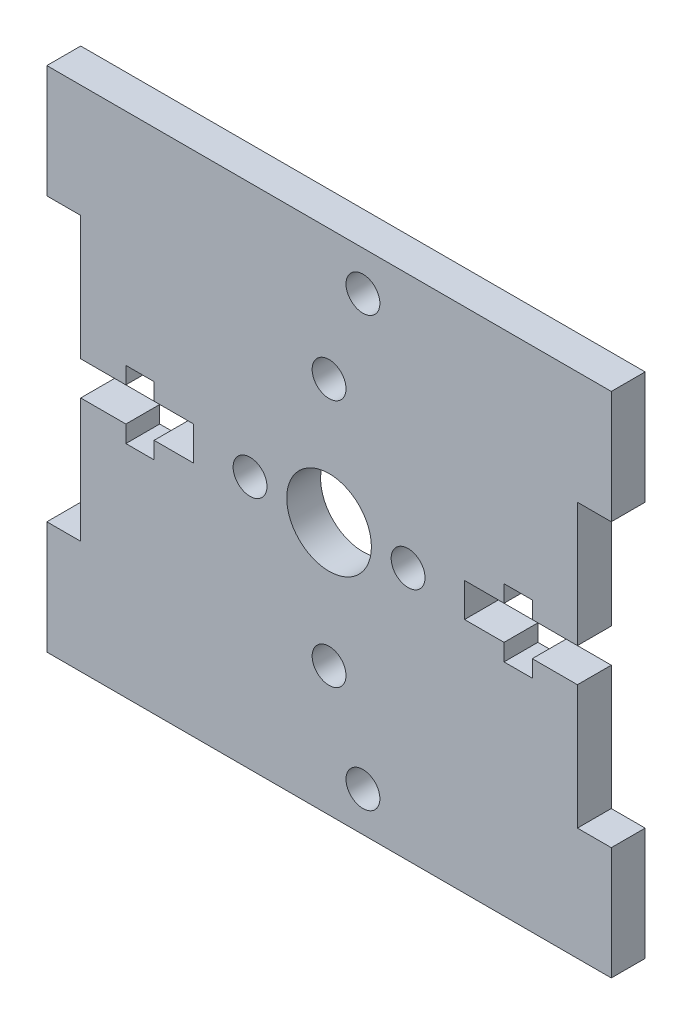
from build123d import *

# Parameters (mm, degrees)
ESQUISSE11_R        = 3.75
ESQUISSE11_R_2      = 1.5
BOSS_EXTRU_11_DEPTH = 3


with BuildPart() as part:
    # Esquisse11 → Boss.-Extru.11 (new body)
    with BuildSketch(Plane.XY):
        Polygon((-66.008134961, -86.49661352), (-66.008134961, -75.49661352), (-69.008134961, -75.49661352), (-69.008134961, -65.49661352), (-19.008134961, -65.49661352), (-19.008134961, -75.49661352), (-22.008134961, -75.49661352), (-22.008134961, -86.49661352), (-26.008134961, -86.49661352), (-26.008134961, -84.99661352), (-28.508134961, -84.99661352), (-28.508134961, -86.49661352), (-32.008134961, -86.49661352), (-32.008134961, -89.49661352), (-28.508134961, -89.49661352), (-28.508134961, -90.99661352), (-26.008134961, -90.99661352), (-26.008134961, -89.49661352), (-22.008134961, -89.49661352), (-22.008134961, -100.49661352), (-19.008134961, -100.49661352), (-19.008134961, -110.49661352), (-69.008134961, -110.49661352), (-69.008134961, -100.49661352), (-66.008134961, -100.49661352), (-66.008134961, -89.49661352), (-62.008134961, -89.49661352), (-62.008134961, -90.99661352), (-59.508134961, -90.99661352), (-59.508134961, -89.49661352), (-56.008134961, -89.49661352), (-56.008134961, -86.49661352), (-59.508134961, -86.49661352), (-59.508134961, -84.99661352), (-62.008134961, -84.99661352), (-62.008134961, -86.49661352), align=None)
        with Locations((-44.008134961, -88.045619642)):
            Circle(ESQUISSE11_R, mode=Mode.SUBTRACT)
        with Locations((-37.008134961, -88.045619642)):
            Circle(ESQUISSE11_R_2, mode=Mode.SUBTRACT)
        with Locations((-51.008134961, -88.045619642)):
            Circle(ESQUISSE11_R_2, mode=Mode.SUBTRACT)
        with Locations((-44.008134961, -77.045619642)):
            Circle(ESQUISSE11_R_2, mode=Mode.SUBTRACT)
        with Locations((-44.008134961, -99.045619642)):
            Circle(ESQUISSE11_R_2, mode=Mode.SUBTRACT)
        with Locations((-41.008134961, -68.99661352)):
            Circle(ESQUISSE11_R_2, mode=Mode.SUBTRACT)
        with Locations((-41.008134961, -106.99661352)):
            Circle(ESQUISSE11_R_2, mode=Mode.SUBTRACT)
    extrude(amount=BOSS_EXTRU_11_DEPTH)


solid = part.part
